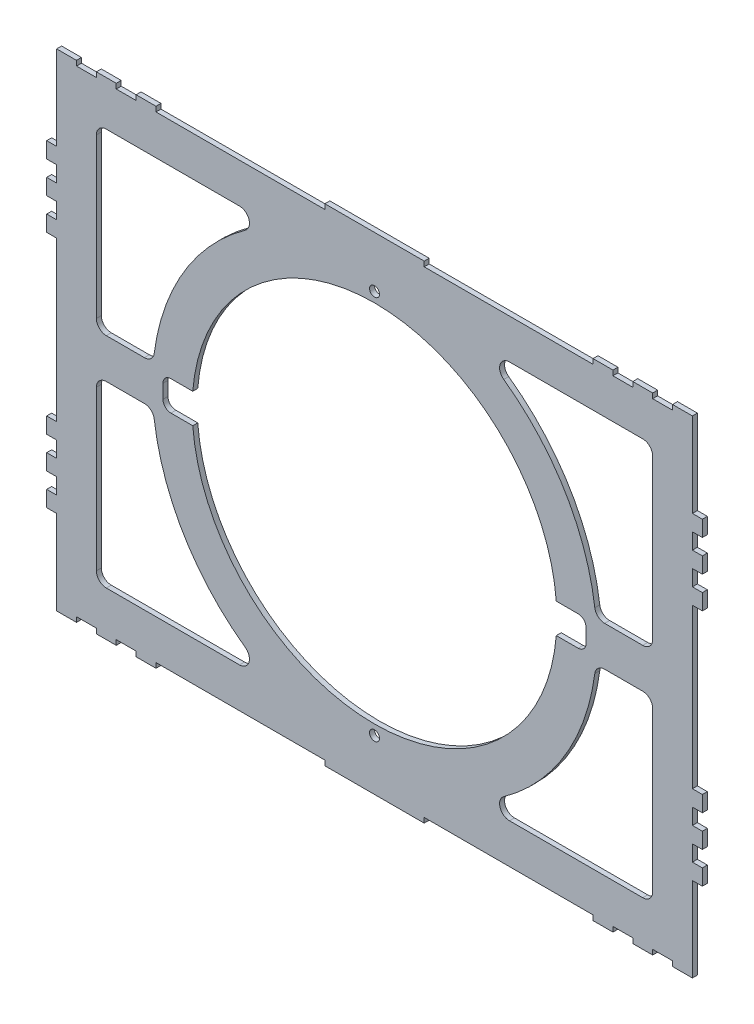
from build123d import *

# Parameters (mm, degrees)
SKETCH1_W                 = 419.1
SKETCH1_H                 = 311.15
SKETCH1_R                 = 116.5733
BOSS_EXTRUDE1_DEPTH       = 3.175
SKETCH2_R                 = 3.175
CUT_EXTRUDE1_DEPTH        = 3.175
CUT_EXTRUDE2_START        = -3.175
CUT_EXTRUDE2_DEPTH        = 3.175
SKETCH4_W                 = 107.95
SKETCH4_H                 = 3.175
SKETCH4_W_2               = 12.7
CUT_EXTRUDE3_DEPTH        = 3.175
MIRROR3_COPY_1_SKETCH_W   = 107.95
MIRROR3_COPY_1_SKETCH_H   = 3.175
MIRROR3_COPY_1_SKETCH_W_2 = 12.7
MIRROR3_COPY_1_DEPTH      = 3.175
SKETCH6_W                 = 6.35
SKETCH6_H                 = 50.8
SKETCH6_H_2               = 10.16
CUT_EXTRUDE4_DEPTH        = 3.175
MIRROR5_COPY_1_SKETCH_W   = 6.35
MIRROR5_COPY_1_SKETCH_H   = 50.8
MIRROR5_COPY_1_SKETCH_H_2 = 10.16
MIRROR5_COPY_1_DEPTH      = 3.175


with BuildPart() as part:
    # Sketch1 → Boss-Extrude1 (new body)
    with BuildSketch(Plane.XY):
        Rectangle(SKETCH1_W, SKETCH1_H)
        Circle(SKETCH1_R, mode=Mode.SUBTRACT)
        with BuildLine():
            Line((-86.296850441, 127), (-171.45, 127))
            ThreePointArc((-171.45, 127), (-175.940128061, 125.140128061), (-177.8, 120.65))
            Line((-177.8, 120.65), (-177.8, 19.05))
            ThreePointArc((-177.8, 19.05), (-175.940128061, 14.559871939), (-171.45, 12.7))
            Line((-171.45, 12.7), (-147.107669399, 12.7))
            ThreePointArc((-147.107669399, 12.7), (-142.915766684, 14.28025665), (-140.810252045, 18.234503425))
            ThreePointArc((-140.810252045, 18.234503425), (-121.830839941, 72.91961763), (-82.602635953, 115.485188356))
            ThreePointArc((-82.602635953, 115.485188356), (-80.250402974, 122.589838403), (-86.296850441, 127))
        make_face(mode=Mode.SUBTRACT)
        with BuildLine():
            Line((-177.8, -120.65), (-177.8, -19.05))
            ThreePointArc((-177.8, -19.05), (-175.940128061, -14.559871939), (-171.45, -12.7))
            Line((-171.45, -12.7), (-147.107669399, -12.7))
            ThreePointArc((-147.107669399, -12.7), (-142.915766684, -14.28025665), (-140.810252045, -18.234503425))
            ThreePointArc((-140.810252045, -18.234503425), (-121.830839941, -72.91961763), (-82.602635953, -115.485188356))
            ThreePointArc((-82.602635953, -115.485188356), (-80.250402974, -122.589838403), (-86.296850441, -127))
            Line((-86.296850441, -127), (-171.45, -127))
            ThreePointArc((-171.45, -127), (-175.940128061, -125.140128061), (-177.8, -120.65))
        make_face(mode=Mode.SUBTRACT)
        with BuildLine():
            Line((86.296850441, -127), (171.45, -127))
            ThreePointArc((171.45, -127), (175.940128061, -125.140128061), (177.8, -120.65))
            Line((177.8, -120.65), (177.8, -19.05))
            ThreePointArc((177.8, -19.05), (175.940128061, -14.559871939), (171.45, -12.7))
            Line((171.45, -12.7), (147.107669399, -12.7))
            ThreePointArc((147.107669399, -12.7), (142.915766684, -14.28025665), (140.810252045, -18.234503425))
            ThreePointArc((140.810252045, -18.234503425), (121.830839941, -72.91961763), (82.602635953, -115.485188356))
            ThreePointArc((82.602635953, -115.485188356), (80.250402974, -122.589838403), (86.296850441, -127))
        make_face(mode=Mode.SUBTRACT)
        with BuildLine():
            Line((177.8, 120.65), (177.8, 19.05))
            ThreePointArc((177.8, 19.05), (175.940128061, 14.559871939), (171.45, 12.7))
            Line((171.45, 12.7), (147.107669399, 12.7))
            ThreePointArc((147.107669399, 12.7), (142.915766684, 14.28025665), (140.810252045, 18.234503425))
            ThreePointArc((140.810252045, 18.234503425), (121.830839941, 72.91961763), (82.602635953, 115.485188356))
            ThreePointArc((82.602635953, 115.485188356), (80.250402974, 122.589838403), (86.296850441, 127))
            Line((86.296850441, 127), (171.45, 127))
            ThreePointArc((171.45, 127), (175.940128061, 125.140128061), (177.8, 120.65))
        make_face(mode=Mode.SUBTRACT)
    extrude(amount=BOSS_EXTRUDE1_DEPTH)

    # Sketch2 → Cut-Extrude1 (cut)
    with BuildSketch(Plane.XY.offset(3.175)):
        with Locations(Location((0, 122.936, 0), (0, 0, 180))):
            Circle(SKETCH2_R)
        with Locations((0, -122.936)):
            Circle(SKETCH2_R)
    extrude(amount=-CUT_EXTRUDE1_DEPTH, mode=Mode.SUBTRACT)

    # Sketch3 → Cut-Extrude2 (cut)
    with BuildSketch(Plane.XY.offset(3.175).offset(CUT_EXTRUDE2_START)):
        with BuildLine():
            Line((116.183512806, -9.525), (130.153512806, -9.525))
            ThreePointArc((130.153512806, -9.525), (133.745615254, -8.037102448), (135.233512806, -4.445))
            Line((135.233512806, -4.445), (135.233512806, 4.445))
            ThreePointArc((135.233512806, 4.445), (133.745615254, 8.037102448), (130.153512806, 9.525))
            Line((130.153512806, 9.525), (116.183512806, 9.525))
            ThreePointArc((116.183512806, 9.525), (116.5733, 0), (116.183512806, -9.525))
        make_face()
    cut_extrude2 = extrude(amount=CUT_EXTRUDE2_DEPTH, mode=Mode.SUBTRACT)

    # Mirror6: Cut-Extrude2 across plane
    add(cut_extrude2.mirror(Plane(origin=(0, 0, 0), x_dir=(0, 0, 1), z_dir=(1, 0, 0))), mode=Mode.SUBTRACT)

    # Sketch4 → Cut-Extrude3 (cut)
    with BuildSketch(Plane.XY.offset(3.175)):
        with Locations((-85.725, 153.9875)):
            Rectangle(SKETCH4_W, SKETCH4_H)
        with Locations((-184.15, 153.9875)):
            Rectangle(SKETCH4_W_2, SKETCH4_H)
        with Locations((-209.55, 153.9875)):
            Rectangle(SKETCH4_W_2, SKETCH4_H)
        with Locations((-158.75, 153.9875)):
            Rectangle(SKETCH4_W_2, SKETCH4_H)
    cut_extrude3 = extrude(amount=-CUT_EXTRUDE3_DEPTH, mode=Mode.SUBTRACT)

    # Mirror2: Cut-Extrude3 across plane
    add(cut_extrude3.mirror(Plane(origin=(0, 0, 0), x_dir=(0, 0, 1), z_dir=(1, 0, 0))), mode=Mode.SUBTRACT)

    # Mirror3: Cut-Extrude3 across plane
    add(cut_extrude3.mirror(Plane.ZX), mode=Mode.SUBTRACT)

    # Mirror3 copy 1 sketch → Mirror3 copy 1 (cut)
    with BuildSketch(Plane(origin=(0, 0, 3.175), x_dir=(-1, 0, 0), z_dir=(0, 0, 1))):
        with Locations((-85.725, 153.9875)):
            Rectangle(MIRROR3_COPY_1_SKETCH_W, MIRROR3_COPY_1_SKETCH_H)
        with Locations((-184.15, 153.9875)):
            Rectangle(MIRROR3_COPY_1_SKETCH_W_2, MIRROR3_COPY_1_SKETCH_H)
        with Locations((-209.55, 153.9875)):
            Rectangle(MIRROR3_COPY_1_SKETCH_W_2, MIRROR3_COPY_1_SKETCH_H)
        with Locations((-158.75, 153.9875)):
            Rectangle(MIRROR3_COPY_1_SKETCH_W_2, MIRROR3_COPY_1_SKETCH_H)
    extrude(amount=-MIRROR3_COPY_1_DEPTH, mode=Mode.SUBTRACT)

    # Sketch6 → Cut-Extrude4 (cut)
    with BuildSketch(Plane.XY.offset(3.175)):
        with Locations((-206.375, 127)):
            Rectangle(SKETCH6_W, SKETCH6_H)
        with Locations((-206.375, 25.4)):
            Rectangle(SKETCH6_W, SKETCH6_H)
        with Locations((-206.375, 86.36)):
            Rectangle(SKETCH6_W, SKETCH6_H_2)
        with Locations((-206.375, 66.04)):
            Rectangle(SKETCH6_W, SKETCH6_H_2)
    cut_extrude4 = extrude(amount=-CUT_EXTRUDE4_DEPTH, mode=Mode.SUBTRACT)

    # Mirror4: Cut-Extrude4 across plane
    add(cut_extrude4.mirror(Plane(origin=(0, 0, 0), x_dir=(0, 0, 1), z_dir=(1, 0, 0))), mode=Mode.SUBTRACT)

    # Mirror5: Cut-Extrude4 across plane
    add(cut_extrude4.mirror(Plane.ZX), mode=Mode.SUBTRACT)

    # Mirror5 copy 1 sketch → Mirror5 copy 1 (cut)
    with BuildSketch(Plane(origin=(0, 0, 3.175), x_dir=(-1, 0, 0), z_dir=(0, 0, 1))):
        with Locations((-206.375, 127)):
            Rectangle(MIRROR5_COPY_1_SKETCH_W, MIRROR5_COPY_1_SKETCH_H)
        with Locations((-206.375, 25.4)):
            Rectangle(MIRROR5_COPY_1_SKETCH_W, MIRROR5_COPY_1_SKETCH_H)
        with Locations((-206.375, 86.36)):
            Rectangle(MIRROR5_COPY_1_SKETCH_W, MIRROR5_COPY_1_SKETCH_H_2)
        with Locations((-206.375, 66.04)):
            Rectangle(MIRROR5_COPY_1_SKETCH_W, MIRROR5_COPY_1_SKETCH_H_2)
    extrude(amount=-MIRROR5_COPY_1_DEPTH, mode=Mode.SUBTRACT)


solid = part.part
